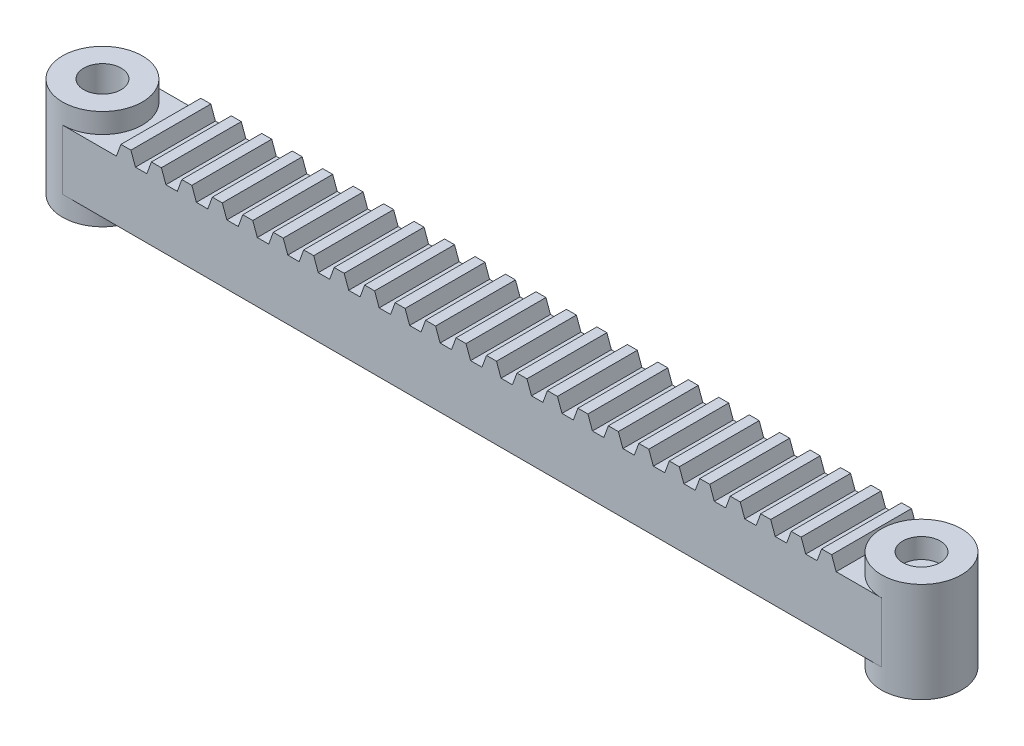
from build123d import *

# Parameters (mm, degrees)
SKETCH2_R             = 8
SKETCH2_R_2           = 3.75
BOSS_EXTRUDE1_DEPTH   = 20
BOSS_EXTRUDE1_2_DEPTH = 20
SKETCH4_W             = 164
SKETCH4_H             = 16
BOSS_EXTRUDE2_DEPTH   = 12
BOSS_EXTRUDE3_DEPTH   = 16
LPATTERN2_COUNT       = 24
LPATTERN2_PITCH       = 6.1


with BuildPart() as part:
    # Sketch2 → Boss-Extrude1 (new body)
    with BuildSketch(Plane(origin=(0, 0, 0), x_dir=(1, 0, 0), z_dir=(0, 1, 0))):
        with Locations(Location((-82, 0, 0), (0, 0, 270))):
            Circle(SKETCH2_R)
        with Locations(Location((-82, 0, 0), (0, 0, 270))):
            Circle(SKETCH2_R_2, mode=Mode.SUBTRACT)
    extrude(amount=BOSS_EXTRUDE1_DEPTH)



with BuildPart() as body_2:
    # Sketch2 → Boss-Extrude1 2 (new body)
    with BuildSketch(Plane(origin=(0, 0, 0), x_dir=(1, 0, 0), z_dir=(0, 1, 0))):
        with Locations(Location((82, 0, 0), (0, 0, 270))):
            Circle(SKETCH2_R)
        with Locations(Location((82, 0, 0), (0, 0, 270))):
            Circle(SKETCH2_R_2, mode=Mode.SUBTRACT)
    extrude(amount=BOSS_EXTRUDE1_2_DEPTH)


with BuildPart() as part_1:
    add(part.part)

    add(body_2.part)  # Boss-Extrude2 merges body 2
    # Sketch4 → Boss-Extrude2 (add)
    with BuildSketch(Plane(origin=(0, 16, 0), x_dir=(1, 0, 0), z_dir=(0, 1, 0))):
        Rectangle(SKETCH4_W, SKETCH4_H)
    extrude(amount=-BOSS_EXTRUDE2_DEPTH)

    # Sketch5 → Boss-Extrude3 (add, through all)
    with BuildSketch(Plane.XY.offset(8)):
        Polygon((72.909925586, 16), (72, 18.5), (70, 18.5), (69.090074414, 16), align=None)
    boss_extrude3 = extrude(amount=-BOSS_EXTRUDE3_DEPTH)

    # LPattern2: Boss-Extrude3 ×24
    with Locations(*[(-i * LPATTERN2_PITCH, 0, 0) for i in range(1, LPATTERN2_COUNT)]):
        add(boss_extrude3)


solid = part_1.part
